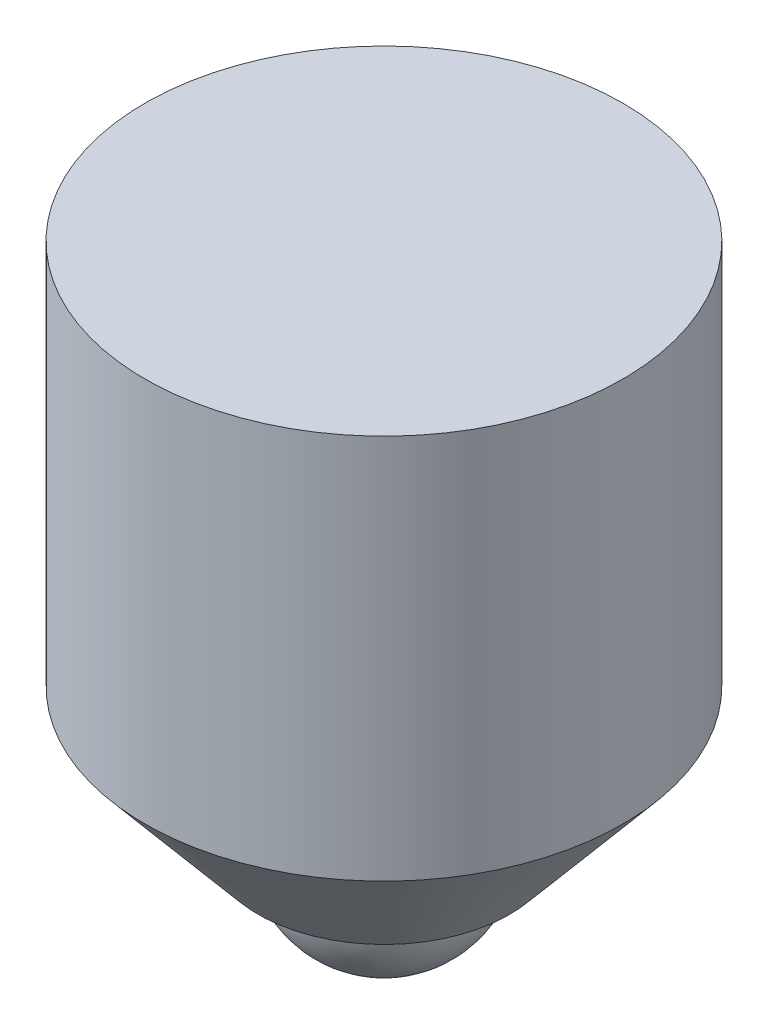
from build123d import *


with BuildPart() as part:
    # Sketch1 → Revolve1 (revolve)
    with BuildSketch(Plane(origin=(0, 0, 0), x_dir=(0, 0, -1), z_dir=(1, 0, 0)), mode=Mode.PRIVATE) as revolve1_sk:
        with BuildLine():
            Line((-0.5, 0.5), (-0.652703645, 0.5))
            Line((-0.652703645, 0.5), (-1.240073386, 1.2))
            Line((-1.240073386, 1.2), (-1.240073386, 3.2))
            Line((-1.240073386, 3.2), (0, 3.2))
            Line((0, 3.2), (0, 0))
            ThreePointArc((0, 0), (-0.353553391, 0.146446609), (-0.5, 0.5))
        make_face()
    revolve(revolve1_sk.sketch.rotate(Axis((0, 0, 0), (0, 1, 0)), 180), axis=Axis((0, 0, 0), (0, 1, 0)))


solid = part.part
